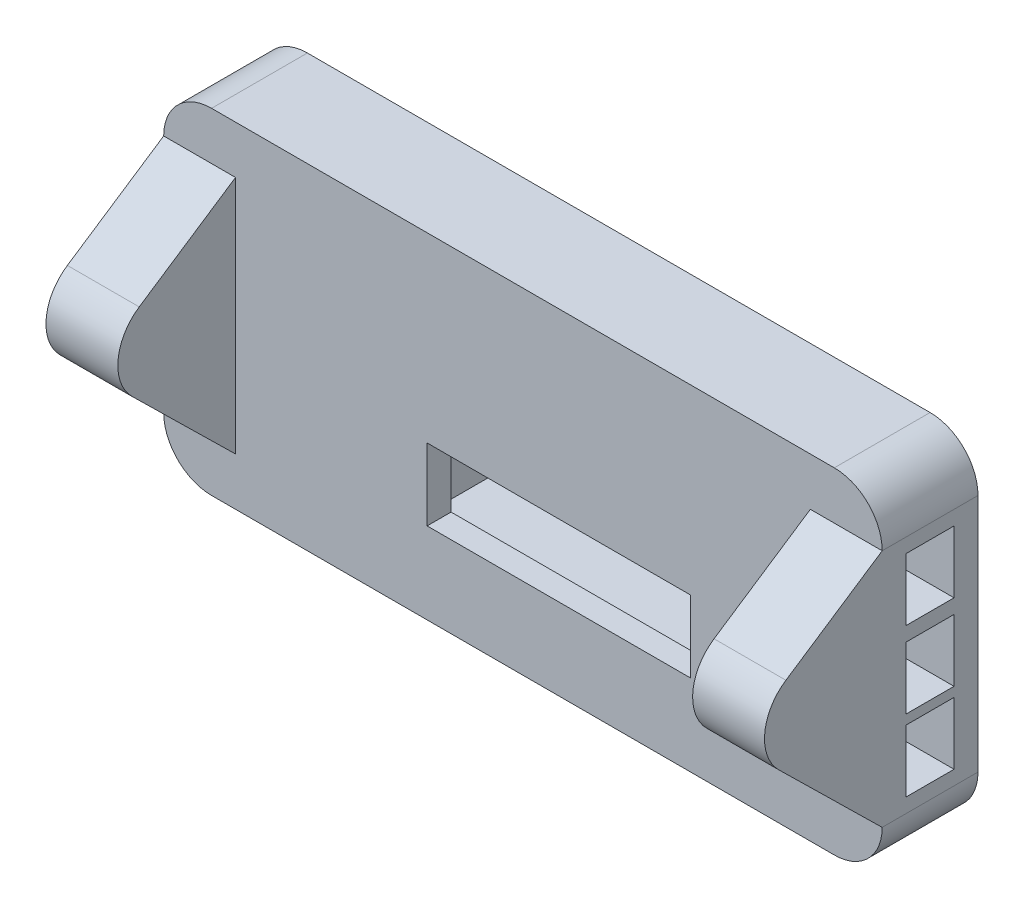
from build123d import *

# Parameters (mm, degrees)
SKETCH1_W           = 150
SKETCH1_H           = 70
BOSS_EXTRUDE1_DEPTH = 20
FILLET1_R           = 10
SKETCH2_W           = 80
SKETCH2_H           = 35
CUT_EXTRUDE1_DEPTH  = 15
SKETCH3_R           = 7
CUT_EXTRUDE2_DEPTH  = 15
SKETCH4_W           = 10
SKETCH4_H           = 13
CUT_EXTRUDE3_DEPTH  = 15
SKETCH6_W           = 4
SKETCH6_H           = 35
CUT_EXTRUDE4_DEPTH  = 25
SKETCH7_W           = 55
SKETCH7_H           = 15
CUT_EXTRUDE5_DEPTH  = 5
BOSS_EXTRUDE3_DEPTH = 15
FILLET2_R           = 10
BOSS_EXTRUDE4_DEPTH = 15


with BuildPart() as part:
    # Sketch1 → Boss-Extrude1 (new body)
    with BuildSketch(Plane.XY):
        with Locations((-0.892857143, 8.973214286)):
            Rectangle(SKETCH1_W, SKETCH1_H)
    extrude(amount=BOSS_EXTRUDE1_DEPTH)

    # Fillet1
    fillet1_edges = [part.edges().sort_by_distance(p)[0] for p in [
        (-75.892857143, 43.973214286, 10),
        (-75.892857143, -26.026785714, 10),
        (74.107142857, -26.026785714, 10),
        (74.107142857, 43.973214286, 10),
    ]]
    fillet(fillet1_edges, radius=FILLET1_R)

    # Sketch2 → Cut-Extrude1 (cut)
    with BuildSketch(Plane(origin=(0, 0, 0), x_dir=(-1, 0, 0), z_dir=(0, 0, -1))):
        with Locations((-15.735916011, 7.430050789)):
            Rectangle(SKETCH2_W, SKETCH2_H)
    extrude(amount=-CUT_EXTRUDE1_DEPTH, mode=Mode.SUBTRACT)

    # Sketch3 → Cut-Extrude2 (cut)
    with BuildSketch(Plane(origin=(0, 0, 0), x_dir=(-1, 0, 0), z_dir=(0, 0, -1))):
        with Locations((40.615191865, 4.17256305)):
            Circle(SKETCH3_R)
    extrude(amount=-CUT_EXTRUDE2_DEPTH, mode=Mode.SUBTRACT)

    # Sketch4 → Cut-Extrude3 (cut)
    with BuildSketch(Plane(origin=(74.107142857, 0, 0), x_dir=(0, 0, -1), z_dir=(1, 0, 0))):
        with Locations((-10, 24.473214286)):
            Rectangle(SKETCH4_W, SKETCH4_H)
        with Locations((-10, 8.473214286)):
            Rectangle(SKETCH4_W, SKETCH4_H)
        with Locations((-10, -6.526785714)):
            Rectangle(SKETCH4_W, SKETCH4_H)
    extrude(amount=-CUT_EXTRUDE3_DEPTH, mode=Mode.SUBTRACT)

    # Sketch6 → Cut-Extrude4 (cut)
    with BuildSketch(Plane.ZY.offset(75.892857143)):
        with Locations((15, 9.473214286)):
            Rectangle(SKETCH6_W, SKETCH6_H)
    extrude(amount=-CUT_EXTRUDE4_DEPTH, mode=Mode.SUBTRACT)

    # Sketch7 → Cut-Extrude5 (cut)
    with BuildSketch(Plane.XY.offset(20)):
        with Locations((6.607142857, -1.526785714)):
            Rectangle(SKETCH7_W, SKETCH7_H)
    extrude(amount=-CUT_EXTRUDE5_DEPTH, mode=Mode.SUBTRACT)

    # Sketch9 → Boss-Extrude3 (add)
    with BuildSketch(Plane.ZY.offset(75.892857143)):
        Polygon((20, 33.973214286), (50.38122201, 13.795245322), (20, -16.026785714), align=None)
    extrude(amount=-BOSS_EXTRUDE3_DEPTH)

    # Fillet2
    fillet2_edges = [part.edges().sort_by_distance(p)[0] for p in [
        (-68.392857143, 13.795245322, 50.38122201),
    ]]
    fillet(fillet2_edges, radius=FILLET2_R)

    # Sketch11 → Boss-Extrude4 (add)
    with BuildSketch(Plane(origin=(74.107142857, 0, 0), x_dir=(0, 0, -1), z_dir=(1, 0, 0))):
        with BuildLine():
            Line((-20, 33.973214286), (-40.105065579, 20.620249447))
            ThreePointArc((-40.105065579, 20.620249447), (-44.527514661, 13.237920805), (-41.577619266, 5.15368001))
            Line((-41.577619266, 5.15368001), (-20, -16.026785714))
            Line((-20, -16.026785714), (-20, 33.973214286))
        make_face()
    extrude(amount=-BOSS_EXTRUDE4_DEPTH)


solid = part.part
